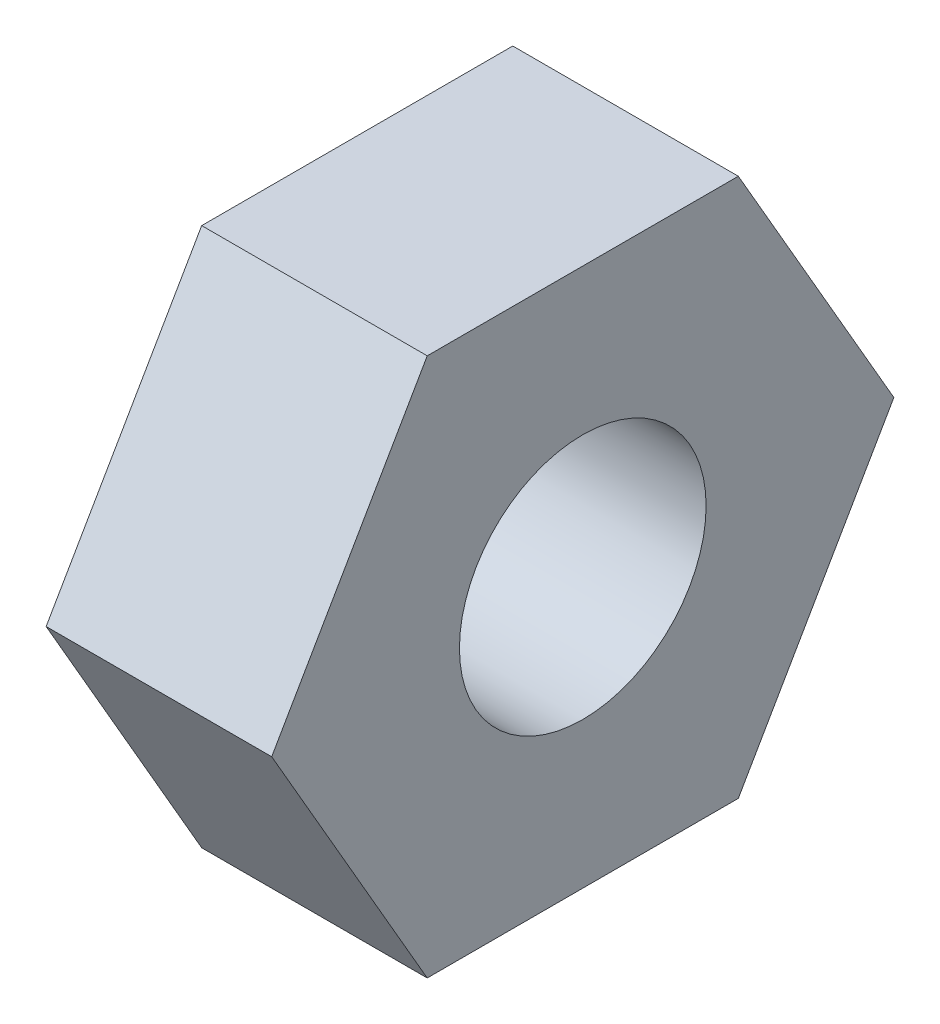
from build123d import *

# Parameters (mm, degrees)
BOSS_EXTRUDE1_DEPTH             = 2.286
TAP_DRILL_FOR_M3X0_5_TAP1_D     = 2.5
TAP_DRILL_FOR_M3X0_5_TAP1_DEPTH = 25.4
TAP_DRILL_FOR_M3X0_5_TAP1_TIP   = 0.751075774


with BuildPart() as part:
    # Sketch1 → Boss-Extrude1 (new body)
    with BuildSketch(Plane.YZ):
        Polygon((0, -3.15290982), (2.7305, -1.57645491), (2.7305, 1.57645491), (0, 3.15290982), (-2.7305, 1.57645491), (-2.7305, -1.57645491), align=None)
    extrude(amount=BOSS_EXTRUDE1_DEPTH)

    # Tap Drill for M3x0.5 Tap1
    with Locations(Plane(origin=(2.286, 0, 0), x_dir=(0, 0, -1), z_dir=(1, 0, 0))):
        with Locations((0, 0)):
            Hole(TAP_DRILL_FOR_M3X0_5_TAP1_D / 2, depth=TAP_DRILL_FOR_M3X0_5_TAP1_DEPTH)
            with Locations((0, 0, -(TAP_DRILL_FOR_M3X0_5_TAP1_DEPTH + TAP_DRILL_FOR_M3X0_5_TAP1_TIP / 2))):  # 118° drill point
                Cone(0, TAP_DRILL_FOR_M3X0_5_TAP1_D / 2, TAP_DRILL_FOR_M3X0_5_TAP1_TIP, mode=Mode.SUBTRACT)


solid = part.part
